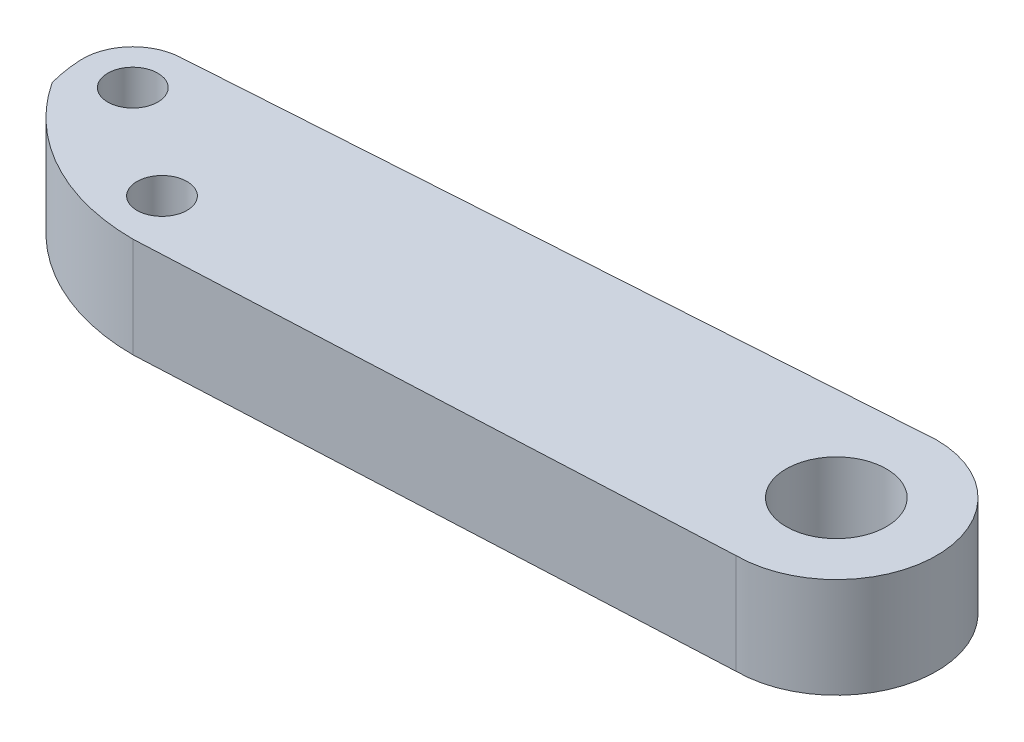
from build123d import *

# Parameters (mm, degrees)
SKETCH2_R           = 1
SKETCH2_R_2         = 2
BOSS_EXTRUDE1_DEPTH = 4


with BuildPart() as part:
    # Sketch2 → Boss-Extrude1 (new body)
    with BuildSketch(Plane(origin=(0, 0, 0), x_dir=(1, 0, 0), z_dir=(0, 1, 0))):
        with BuildLine():
            ThreePointArc((-11.516754324, -1.593462652), (-8.479529409, -4.383974358), (-4.480887679, -5.395189011))
            Line((-4.480887679, -5.395189011), (-3.678548279, -5.356835657))
            Line((-3.678548279, -5.356835657), (18.483980616, -4.297424484))
            ThreePointArc((18.483980616, -4.297424484), (22.483980616, -0.297424484), (18.483980616, 3.702575516))
            Line((18.483980616, 3.702575516), (17.958963471, 3.667970452))
            Line((17.958963471, 3.667970452), (-9.863309787, 1.834141673))
            ThreePointArc((-9.863309787, 1.834141673), (-11.226928025, 1.166818548), (-11.729046011, -0.26588951))
            ThreePointArc((-11.729046011, -0.26588951), (-11.658234536, -0.935326386), (-11.516754324, -1.593462652))
        make_face()
        with Locations(Location((-5.405665929, -3.321328339, 0), (0, 0, 270))):
            Circle(SKETCH2_R, mode=Mode.SUBTRACT)
        with Locations(Location((-9.731770698, -0.161528006, 0), (0, 0, 270))):
            Circle(SKETCH2_R, mode=Mode.SUBTRACT)
        with Locations(Location((18.483980616, -0.297424484, 0), (0, 0, 270))):
            Circle(SKETCH2_R_2, mode=Mode.SUBTRACT)
    extrude(amount=BOSS_EXTRUDE1_DEPTH)


solid = part.part
